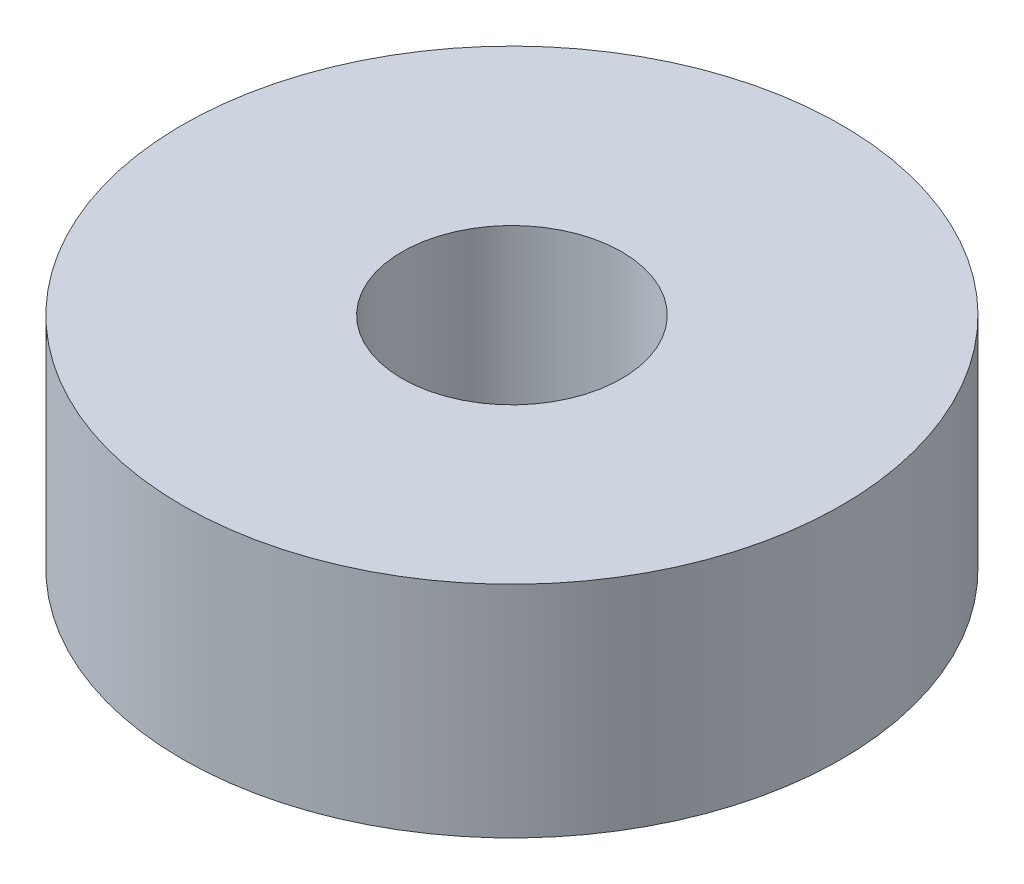
from build123d import *

# Parameters (mm, degrees)
SKETCH1_R           = 9.525
SKETCH1_R_2         = 3.175
BOSS_EXTRUDE1_DEPTH = 6.35


with BuildPart() as part:
    # Sketch1 → Boss-Extrude1 (new body)
    with BuildSketch(Plane(origin=(0, 0, 0), x_dir=(1, 0, 0), z_dir=(0, 1, 0))):
        with Locations(Location((0, 0, 0), (0, 0, 270))):
            Circle(SKETCH1_R)
        with Locations(Location((0, 0, 0), (0, 0, 270))):
            Circle(SKETCH1_R_2, mode=Mode.SUBTRACT)
    extrude(amount=BOSS_EXTRUDE1_DEPTH)


solid = part.part
